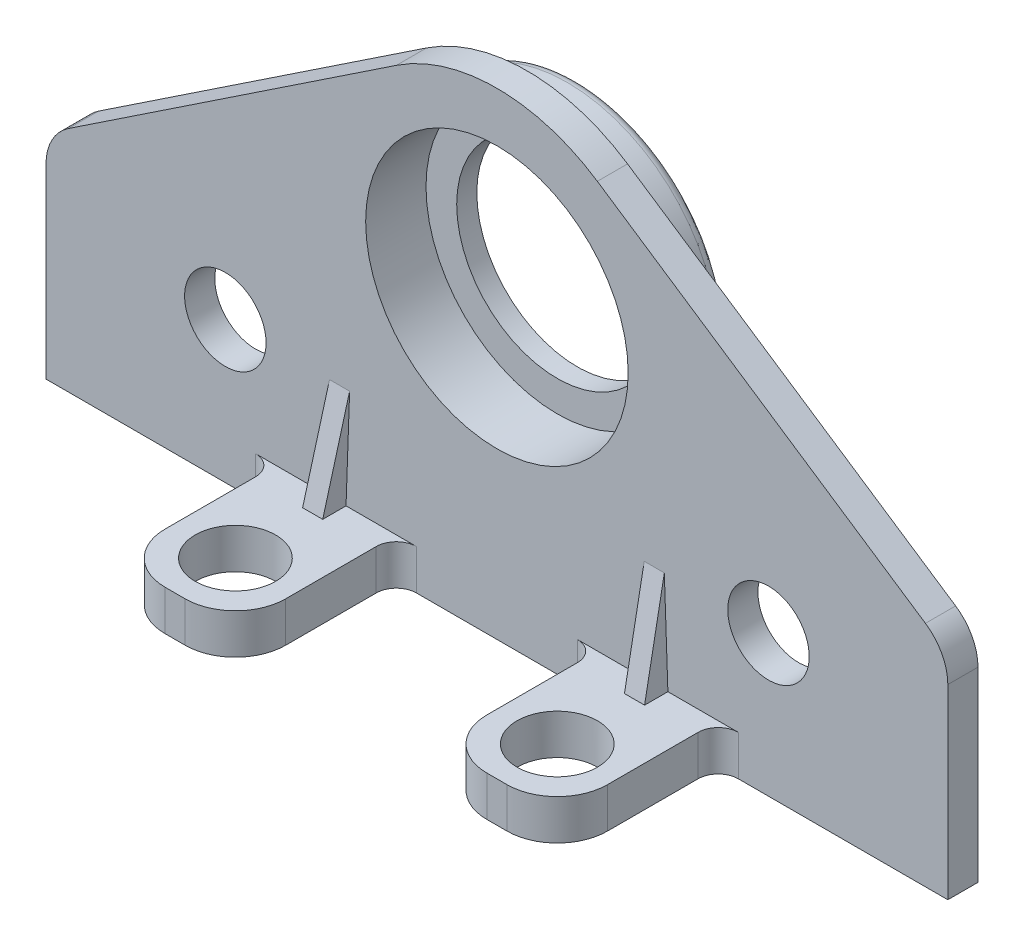
from build123d import *

# Parameters (mm, degrees)
SALIENTE_EXTRUIR1_DEPTH = 23
SALIENTE_EXTRUIR2_DEPTH = 2
CROQUIS3_W              = 74.8935
CROQUIS3_H              = 50
SALIENTE_EXTRUIR3_DEPTH = 2
CROQUIS4_R              = 4.05
SALIENTE_EXTRUIR4_DEPTH = 50
CHAFL_N2_SIZE           = 1
CROQUIS7_R              = 4.05
CROQUIS7_R_2            = 13.05
SALIENTE_EXTRUIR5_DEPTH = 6
CROQUIS8_W              = 12
CROQUIS8_H              = 4
SALIENTE_EXTRUIR6_DEPTH = 16
REDONDEO3_R             = 2
REDONDEO4_R             = 5
CROQUIS14_R             = 4
CORTAR_EXTRUIR1_DEPTH   = 10
SALIENTE_EXTRUIR7_DEPTH = 1
CROQUIS20_R             = 4.05
CROQUIS20_R_2           = 10
SALIENTE_EXTRUIR8_DEPTH = 2
CHAFL_N3_SIZE           = 1
CROQUIS22_R             = 5.05
CROQUIS22_R_2           = 15
CORTAR_EXTRUIR3_DEPTH   = 5
REDONDEO6_R             = 1


with BuildPart() as part:
    # Croquis1 → Saliente-Extruir1 (new, symmetric)
    with BuildSketch(Plane.XY):
        Polygon((-7.48935, 0), (7.48935, 0), (0.00065, 21.6199), align=None)
    extrude(amount=SALIENTE_EXTRUIR1_DEPTH, both=True)

    # Croquis2 → Saliente-Extruir2 (add)
    with BuildSketch(Plane.XY.offset(23)):
        Polygon((37.44675, 0), (-37.44675, 0), (0.00065, 21.6199), align=None)
    saliente_extruir2 = extrude(amount=SALIENTE_EXTRUIR2_DEPTH)

    # Simetría1: Saliente-Extruir2 across plane
    add(saliente_extruir2.mirror(Plane.XY))

    # Croquis3 → Saliente-Extruir3 (add)
    with BuildSketch(Plane.XZ):
        Rectangle(CROQUIS3_W, CROQUIS3_H)
    extrude(amount=SALIENTE_EXTRUIR3_DEPTH)

    # Croquis4 → Saliente-Extruir4 (add)
    with BuildSketch(Plane.XY.offset(25)):
        with BuildLine():
            Line((7.743545699, -2), (-7.743545699, -2))
            ThreePointArc((-7.743545699, -2), (-6.147743753, -2.794422898), (-5.819683414, -4.546583851))
            ThreePointArc((-5.819683414, -4.546583851), (0, -12.25), (5.819683414, -4.546583851))
            ThreePointArc((5.819683414, -4.546583851), (6.147743753, -2.794422898), (7.743545699, -2))
        make_face()
        with Locations((0, -6.2)):
            Circle(CROQUIS4_R, mode=Mode.SUBTRACT)
    extrude(amount=-SALIENTE_EXTRUIR4_DEPTH)

    # Chaflán2
    chafl_n2_edges = [part.edges().sort_by_distance(p)[0] for p in [
        (-4.05, -6.2, -25),
        (-4.05, -6.2, 25),
    ]]
    chamfer(chafl_n2_edges, length=CHAFL_N2_SIZE)


with BuildPart() as body_2:
    # Croquis7 → Saliente-Extruir5 (new body)
    with BuildSketch(Plane(origin=(0, 0, -25), x_dir=(-1, 0, 0), z_dir=(0, 0, -1))):
        with BuildLine():
            Line((-9.986152883, 8.775872282), (-42.60542858, -12.975186214))
            ThreePointArc((-42.60542858, -12.975186214), (-44.239992249, -14.776089142), (-44.831497223, -17.135150737))
            Line((-44.831497223, -17.135150737), (-44.831497223, -35.665252187))
            Line((-44.831497223, -35.665252187), (44.831497223, -35.665252187))
            Line((44.831497223, -35.665252187), (44.831497223, -17.135150737))
            ThreePointArc((44.831497223, -17.135150737), (44.239992249, -14.776089142), (42.60542858, -12.975186214))
            Line((42.60542858, -12.975186214), (9.986152883, 8.775872282))
            ThreePointArc((9.986152883, 8.775872282), (0, 11.8), (-9.986152883, 8.775872282))
        make_face()
        with Locations((-27, -21.615252187)):
            Circle(CROQUIS7_R, mode=Mode.SUBTRACT)
        with Locations(Location((27, -21.615252187, 0), (0, 0, 180))):
            Circle(CROQUIS7_R, mode=Mode.SUBTRACT)
        with Locations((0, -6.2)):
            Circle(CROQUIS7_R_2, mode=Mode.SUBTRACT)
    extrude(amount=SALIENTE_EXTRUIR5_DEPTH)

    # Croquis8 → Saliente-Extruir6 (add)
    with BuildSketch(Plane.XY.offset(-25)):
        with Locations((-16, -33.665252187)):
            Rectangle(CROQUIS8_W, CROQUIS8_H)
        with Locations((16, -33.665252187)):
            Rectangle(CROQUIS8_W, CROQUIS8_H)
    extrude(amount=SALIENTE_EXTRUIR6_DEPTH)

    # Redondeo3
    redondeo3_edges = [body_2.edges().sort_by_distance(p)[0] for p in [
        (-22, -33.665252187, -25),
        (-10, -33.665252187, -25),
        (22, -33.665252187, -25),
        (10, -33.665252187, -25),
    ]]
    fillet(redondeo3_edges, radius=REDONDEO3_R)

    # Redondeo4
    redondeo4_edges = [body_2.edges().sort_by_distance(p)[0] for p in [
        (-22, -33.665252187, -9),
        (-10, -33.665252187, -9),
        (22, -33.665252187, -9),
        (10, -33.665252187, -9),
    ]]
    fillet(redondeo4_edges, radius=REDONDEO4_R)

    # Croquis14 → Cortar-Extruir1 (cut)
    with BuildSketch(Plane(origin=(0, -31.665252187, 0), x_dir=(1, 0, 0), z_dir=(0, 1, 0))):
        with Locations(Location((-16, 15, 0), (0, 0, 270))):
            Circle(CROQUIS14_R)
        with Locations(Location((16, 15, 0), (0, 0, 270))):
            Circle(CROQUIS14_R)
    extrude(amount=-CORTAR_EXTRUIR1_DEPTH, mode=Mode.SUBTRACT)

    # Croquis3D2 → Saliente-Extruir7 (add, symmetric, along a direction that is not the sketch's normal)
    with BuildSketch(Plane(origin=(-16, -31.665252187, -22.681195735), x_dir=(0.03434705256799914, 0.973825325774171, -0.22468759391813525), z_dir=(-0.9993785848148502, 0.035248322136908906, 0))):
        Polygon((0, 0), (10.320125934, 0), (0.521006551, 2.259514415), align=None)
    saliente_extruir7 = extrude(amount=SALIENTE_EXTRUIR7_DEPTH, dir=(-1, 0, 0), both=True)

    # Simetría2: Saliente-Extruir7 across plane
    add(saliente_extruir7.mirror(Plane(origin=(0, 0, 0), x_dir=(0, 0, 1), z_dir=(1, 0, 0))))

    # Croquis20 → Saliente-Extruir8 (add)
    with BuildSketch(Plane(origin=(0, 0, -31), x_dir=(-1, 0, 0), z_dir=(0, 0, -1))):
        with BuildLine():
            Line((42.60542858, -12.975186214), (9.986152883, 8.775872282))
            ThreePointArc((9.986152883, 8.775872282), (0, 11.8), (-9.986152883, 8.775872282))
            Line((-9.986152883, 8.775872282), (-42.60542858, -12.975186214))
            ThreePointArc((-42.60542858, -12.975186214), (-44.239992249, -14.776089142), (-44.831497223, -17.135150737))
            Line((-44.831497223, -17.135150737), (-44.831497223, -35.665252187))
            Line((-44.831497223, -35.665252187), (44.831497223, -35.665252187))
            Line((44.831497223, -35.665252187), (44.831497223, -17.135150737))
            ThreePointArc((44.831497223, -17.135150737), (44.239992249, -14.776089142), (42.60542858, -12.975186214))
        make_face()
        with Locations((-27, -21.615252187)):
            Circle(CROQUIS20_R, mode=Mode.SUBTRACT)
        with Locations(Location((27, -21.615252187, 0), (0, 0, 180))):
            Circle(CROQUIS20_R, mode=Mode.SUBTRACT)
        with Locations((0, -6.2)):
            Circle(CROQUIS20_R_2, mode=Mode.SUBTRACT)
    extrude(amount=SALIENTE_EXTRUIR8_DEPTH)

    # Chaflán3
    chafl_n3_edges = [body_2.edges().sort_by_distance(p)[0] for p in [
        (31.05, -21.615252187, -33),
        (-31.05, -21.615252187, -33),
    ]]
    chamfer(chafl_n3_edges, length=CHAFL_N3_SIZE)

    # Croquis22 → Cortar-Extruir3 (cut)
    # profile 1 of 3: a face of its own
    with BuildSketch(Plane(origin=(0, 0, -33), x_dir=(-1, 0, 0), z_dir=(0, 0, -1))):
        with BuildLine():
            ThreePointArc((44.831497223, -17.135150737), (44.239992249, -14.776089142), (42.60542858, -12.975186214))
            Line((42.60542858, -12.975186214), (9.986152883, 8.775872282))
            ThreePointArc((9.986152883, 8.775872282), (0, 11.8), (-9.986152883, 8.775872282))
            Line((-9.986152883, 8.775872282), (-42.60542858, -12.975186214))
            ThreePointArc((-42.60542858, -12.975186214), (-44.239992249, -14.776089142), (-44.831497223, -17.135150737))
            Line((-44.831497223, -17.135150737), (-44.831497223, -35.665252187))
            Line((-44.831497223, -35.665252187), (44.831497223, -35.665252187))
            Line((44.831497223, -35.665252187), (44.831497223, -17.135150737))
        make_face()
        with Locations((-27, -21.615252187)):
            Circle(CROQUIS22_R, mode=Mode.SUBTRACT)
        with Locations((27, -21.615252187)):
            Circle(CROQUIS22_R, mode=Mode.SUBTRACT)
        with Locations((0, -6.2)):
            Circle(CROQUIS22_R_2, mode=Mode.SUBTRACT)
    # profile 2 of 3: a face of its own
    with BuildSketch(Plane(origin=(0, 0, -33), x_dir=(-1, 0, 0), z_dir=(0, 0, -1))):
        with Locations((-27, -21.615252187)):
            Circle(CROQUIS22_R)
    # profile 3 of 3: a face of its own
    with BuildSketch(Plane(origin=(0, 0, -33), x_dir=(-1, 0, 0), z_dir=(0, 0, -1))):
        with Locations((27, -21.615252187)):
            Circle(CROQUIS22_R)
    extrude(amount=-CORTAR_EXTRUIR3_DEPTH, mode=Mode.SUBTRACT)

    # Redondeo6
    redondeo6_edges = [body_2.edges().sort_by_distance(p)[0] for p in [
        (15, -6.2, -33),
        (15, -6.2, -28),
    ]]
    fillet(redondeo6_edges, radius=REDONDEO6_R)


solid = body_2.part
